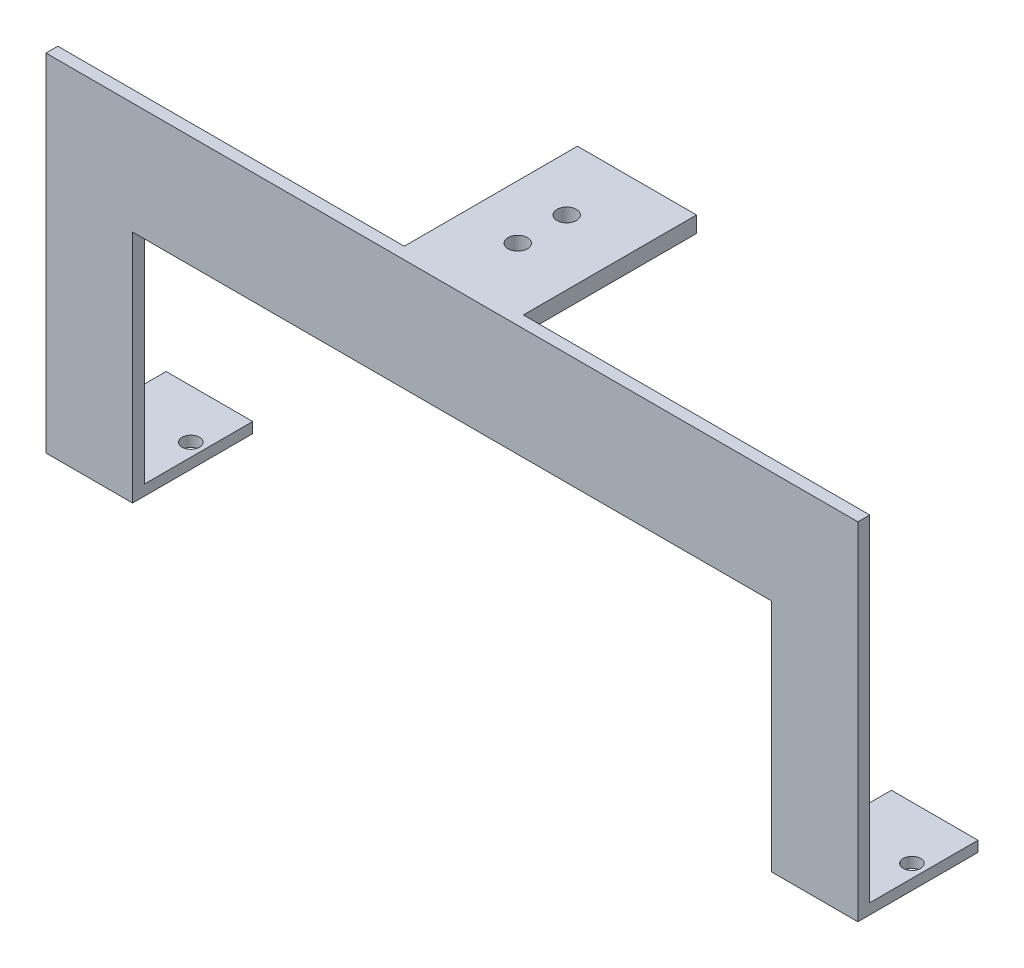
from build123d import *

# Parameters (mm, degrees)
BOSS_EXTRUDE1_DEPTH = 3.4798
SKETCH2_W           = 25.4
SKETCH2_H           = 3.0988
BOSS_EXTRUDE2_DEPTH = 31.75
SKETCH3_W           = 25.4
SKETCH3_H           = 3.0988
BOSS_EXTRUDE3_DEPTH = 31.75
SKETCH4_W           = 34.925
SKETCH4_H           = 4.709822999
BOSS_EXTRUDE4_DEPTH = 50.8
SKETCH5_R           = 2.54
CUT_EXTRUDE1_DEPTH  = 209.009244951
SKETCH6_R           = 2.54
CUT_EXTRUDE2_DEPTH  = 209.009244951
SKETCH7_R           = 2.54
CUT_EXTRUDE3_DEPTH  = 209.009244951
SKETCH8_R           = 2.54
CUT_EXTRUDE4_DEPTH  = 50.8
SKETCH9_R           = 2.843025999
CUT_EXTRUDE5_DEPTH  = 209.009244951
SKETCH10_R          = 2.846976016
CUT_EXTRUDE6_DEPTH  = 50.8


with BuildPart() as part:
    # Sketch1 → Boss-Extrude1 (new body)
    with BuildSketch(Plane.XY):
        Polygon((-174.254543657, -25.729136112), (-148.854543657, -25.729136112), (-148.854543657, 43.104656603), (38.470456343, 43.104656603), (38.470456343, -25.729136112), (63.870456343, -25.729136112), (63.870456343, 75.870863888), (-174.254543657, 75.870863888), align=None)
    extrude(amount=BOSS_EXTRUDE1_DEPTH)

    # Sketch2 → Boss-Extrude2 (add)
    with BuildSketch(Plane(origin=(0, 0, 0), x_dir=(-1, 0, 0), z_dir=(0, 0, -1))):
        with Locations((-51.170456343, -24.179736112)):
            Rectangle(SKETCH2_W, SKETCH2_H)
    extrude(amount=BOSS_EXTRUDE2_DEPTH)

    # Sketch3 → Boss-Extrude3 (add)
    with BuildSketch(Plane(origin=(0, 0, 0), x_dir=(-1, 0, 0), z_dir=(0, 0, -1))):
        with Locations((161.554543657, -24.179736112)):
            Rectangle(SKETCH3_W, SKETCH3_H)
    extrude(amount=BOSS_EXTRUDE3_DEPTH)

    # Sketch4 → Boss-Extrude4 (add)
    with BuildSketch(Plane(origin=(0, 0, 0), x_dir=(-1, 0, 0), z_dir=(0, 0, -1))):
        with Locations((55.192043657, 73.515952389)):
            Rectangle(SKETCH4_W, SKETCH4_H)
    extrude(amount=BOSS_EXTRUDE4_DEPTH)

    # Sketch5 → Cut-Extrude1 (cut, through all)
    with BuildSketch(Plane.XZ.offset(25.729136112)):
        with Locations(Location((42.280456343, -15.3939186, 0), (0, 0, 270))):
            Circle(SKETCH5_R)
    extrude(amount=-CUT_EXTRUDE1_DEPTH, mode=Mode.SUBTRACT)

    # Sketch6 → Cut-Extrude2 (cut, through all)
    with BuildSketch(Plane.XZ.offset(25.729136112)):
        with Locations(Location((-170.444543657, -17.137609378, 0), (0, 0, 270))):
            Circle(SKETCH6_R)
    extrude(amount=-CUT_EXTRUDE2_DEPTH, mode=Mode.SUBTRACT)

    # Sketch7 → Cut-Extrude3 (cut, through all)
    with BuildSketch(Plane.XZ.offset(25.729136112)):
        with Locations(Location((-152.664543657, -17.404243817, 0), (0, 0, 270))):
            Circle(SKETCH7_R)
    extrude(amount=-CUT_EXTRUDE3_DEPTH, mode=Mode.SUBTRACT)

    # Sketch8 → Cut-Extrude4 (cut)
    with BuildSketch(Plane(origin=(0, -25.729136112, 0), x_dir=(-1, 0, 0), z_dir=(0, -1, 0))):
        with Locations(Location((-60.060456343, 16.178164824, 0), (0, 0, 90))):
            Circle(SKETCH8_R)
    extrude(amount=-CUT_EXTRUDE4_DEPTH, mode=Mode.SUBTRACT)

    # Sketch9 → Cut-Extrude5 (cut, through all)
    with BuildSketch(Plane(origin=(0, 75.870863888, 0), x_dir=(1, 0, 0), z_dir=(0, 1, 0))):
        with Locations(Location((-56.779543657, 17.413178819, 0), (0, 0, 180))):
            Circle(SKETCH9_R)
    extrude(amount=-CUT_EXTRUDE5_DEPTH, mode=Mode.SUBTRACT)

    # Sketch10 → Cut-Extrude6 (cut)
    with BuildSketch(Plane(origin=(0, 75.870863888, 0), x_dir=(1, 0, 0), z_dir=(0, 1, 0))):
        with Locations(Location((-56.779543657, 31.75, 0), (0, 0, 180))):
            Circle(SKETCH10_R)
    extrude(amount=-CUT_EXTRUDE6_DEPTH, mode=Mode.SUBTRACT)


solid = part.part
